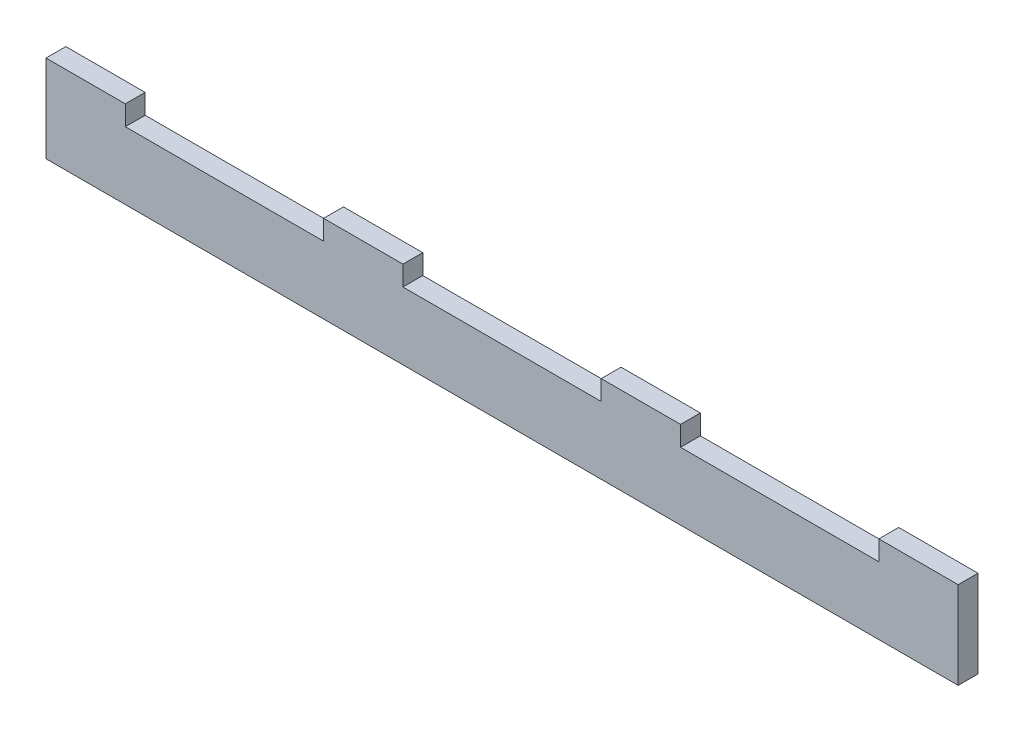
from build123d import *

# Parameters (mm, degrees)
BOSS_EXTRU_2_DEPTH = 5


with BuildPart() as part:
    # Esquisse1 → Boss.-Extru.2 (new body)
    with BuildSketch(Plane.XY):
        Polygon((0, 0), (230, 0), (230, 22), (210, 22), (210, 17), (160, 17), (160, 22), (140, 22), (140, 17), (90, 17), (90, 22), (70, 22), (70, 17), (20, 17), (20, 22), (0, 22), align=None)
    extrude(amount=BOSS_EXTRU_2_DEPTH)


solid = part.part
